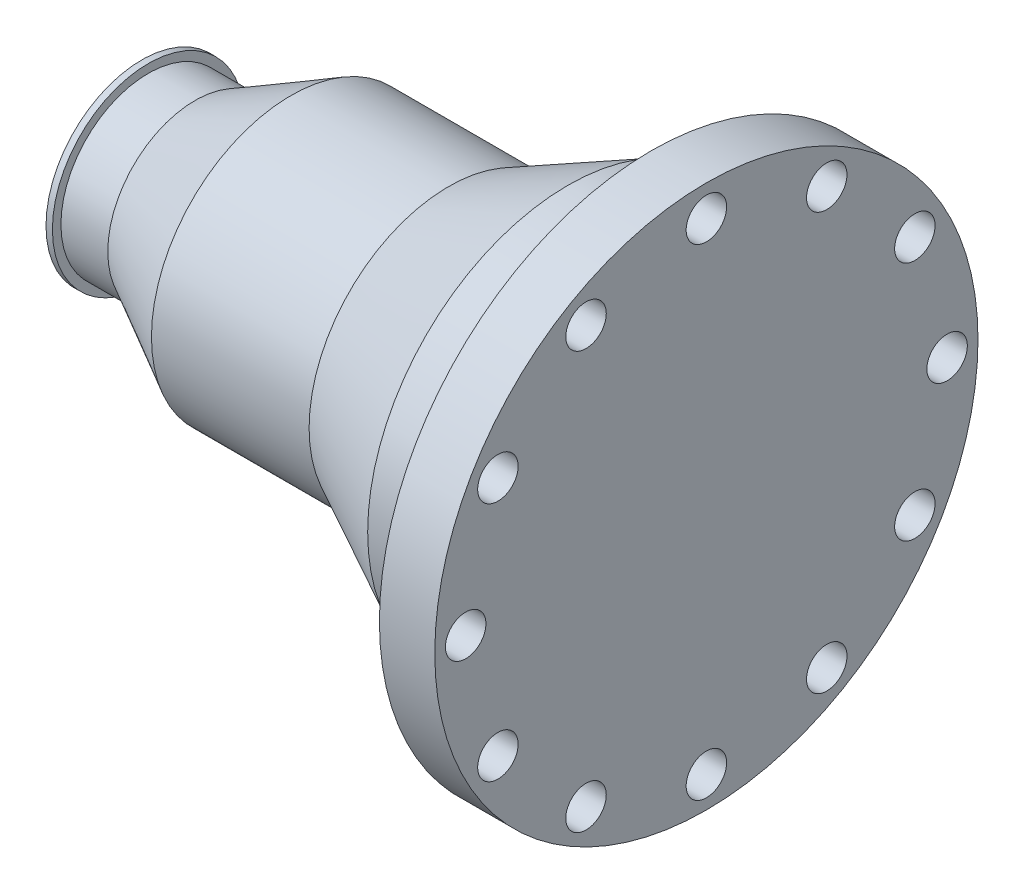
from build123d import *

# Parameters (mm, degrees)
SKETCH_3_R           = 9.5
CUT_EXTRUDE_1_DEPTH  = 321.526909947
SKETCH_4_R           = 9.5
CUT_EXTRUDE_2_DEPTH  = 321.526909947
SKETCH_5_R           = 9.5
CUT_EXTRUDE_3_DEPTH  = 321.526909947
SKETCH_6_R           = 9.5
CUT_EXTRUDE_4_DEPTH  = 321.526909947
SKETCH_7_R           = 9.5
CUT_EXTRUDE_5_DEPTH  = 321.526909947
SKETCH_8_R           = 9.5
CUT_EXTRUDE_6_DEPTH  = 321.526909947
SKETCH_9_R           = 9.5
CUT_EXTRUDE_7_DEPTH  = 321.526909947
SKETCH_10_R          = 9.5
CUT_EXTRUDE_8_DEPTH  = 321.526909947
SKETCH_11_R          = 9.5
CUT_EXTRUDE_9_DEPTH  = 321.526909947
SKETCH_12_R          = 9.5
CUT_EXTRUDE_10_DEPTH = 321.526909947
SKETCH_13_R          = 9.5
CUT_EXTRUDE_11_DEPTH = 321.526909947
SKETCH_14_R          = 9.5
CUT_EXTRUDE_12_DEPTH = 321.526909947


with BuildPart() as part:
    # Эскиз1 → Повернуть1 (revolve)
    with BuildSketch(Plane.XY, mode=Mode.PRIVATE) as revolve_1_sk:
        Polygon((0, 0), (265, 0), (265, 127.5), (239, 127.5), (239, 100), (239, 95), (220, 95), (220, 94), (200, 94), (144, 65.5), (70, 65.5), (25, 41), (3, 41), (3, 45), (0, 45), align=None)
    revolve(revolve_1_sk.sketch.rotate(Axis((0, 0, 0), (1, 0, 0)), 90), axis=Axis((0, 0, 0), (1, 0, 0)))

    # Эскиз2 → Вырез-Повернуть1 (revolve, cut)
    with BuildSketch(Plane.XY, mode=Mode.PRIVATE) as cut_revolve_1_sk:
        with BuildLine():
            Line((0, 0), (152, 0))
            Line((152, 0), (152, 55))
            Line((152, 55), (147.669872, 55))
            ThreePointArc((147.669872, 55), (146.273624348, 54.108499061), (146.669872, 52.5))
            Line((146.669872, 52.5), (143.5, 52.5))
            ThreePointArc((143.5, 52.5), (142.75, 52.602347572), (142, 52.5))
            Line((142, 52.5), (90, 52.5))
            ThreePointArc((90, 52.5), (79.13262933, 46.740617582), (70, 38.502577))
            Line((70, 38.502577), (42, 31))
            Line((42, 31), (0, 31))
            Line((0, 31), (0, 0))
        make_face()
    revolve(cut_revolve_1_sk.sketch.rotate(Axis((0, 0, 0), (1, 0, 0)), 90), axis=Axis((0, 0, 0), (1, 0, 0)), mode=Mode.SUBTRACT)

    # Эскиз3 → Вырез-Вытянуть1 (cut, through all)
    with BuildSketch(Plane(origin=(0, 0, 0), x_dir=(0, 0, -1), z_dir=(1, 0, 0))):
        with Locations((0, 113)):
            Circle(SKETCH_3_R)
    extrude(amount=CUT_EXTRUDE_1_DEPTH, mode=Mode.SUBTRACT)

    # Эскиз4 → Вырез-Вытянуть2 (cut, through all)
    with BuildSketch(Plane(origin=(0, 0, 0), x_dir=(0, 0, -1), z_dir=(1, 0, 0))):
        with Locations((-56.5, 97.860870628)):
            Circle(SKETCH_4_R)
    extrude(amount=CUT_EXTRUDE_2_DEPTH, mode=Mode.SUBTRACT)

    # Эскиз5 → Вырез-Вытянуть3 (cut, through all)
    with BuildSketch(Plane(origin=(0, 0, 0), x_dir=(0, 0, -1), z_dir=(1, 0, 0))):
        with Locations((-97.860870628, 56.5)):
            Circle(SKETCH_5_R)
    extrude(amount=CUT_EXTRUDE_3_DEPTH, mode=Mode.SUBTRACT)

    # Эскиз6 → Вырез-Вытянуть4 (cut, through all)
    with BuildSketch(Plane(origin=(0, 0, 0), x_dir=(0, 0, -1), z_dir=(1, 0, 0))):
        with Locations((-113, 0)):
            Circle(SKETCH_6_R)
    extrude(amount=CUT_EXTRUDE_4_DEPTH, mode=Mode.SUBTRACT)

    # Эскиз7 → Вырез-Вытянуть5 (cut, through all)
    with BuildSketch(Plane(origin=(0, 0, 0), x_dir=(0, 0, -1), z_dir=(1, 0, 0))):
        with Locations((-97.860870628, -56.5)):
            Circle(SKETCH_7_R)
    extrude(amount=CUT_EXTRUDE_5_DEPTH, mode=Mode.SUBTRACT)

    # Эскиз8 → Вырез-Вытянуть6 (cut, through all)
    with BuildSketch(Plane(origin=(0, 0, 0), x_dir=(0, 0, -1), z_dir=(1, 0, 0))):
        with Locations((-56.5, -97.860870628)):
            Circle(SKETCH_8_R)
    extrude(amount=CUT_EXTRUDE_6_DEPTH, mode=Mode.SUBTRACT)

    # Эскиз9 → Вырез-Вытянуть7 (cut, through all)
    with BuildSketch(Plane(origin=(0, 0, 0), x_dir=(0, 0, -1), z_dir=(1, 0, 0))):
        with Locations((0, -113)):
            Circle(SKETCH_9_R)
    extrude(amount=CUT_EXTRUDE_7_DEPTH, mode=Mode.SUBTRACT)

    # Эскиз10 → Вырез-Вытянуть8 (cut, through all)
    with BuildSketch(Plane(origin=(0, 0, 0), x_dir=(0, 0, -1), z_dir=(1, 0, 0))):
        with Locations((56.5, -97.860870628)):
            Circle(SKETCH_10_R)
    extrude(amount=CUT_EXTRUDE_8_DEPTH, mode=Mode.SUBTRACT)

    # Эскиз11 → Вырез-Вытянуть9 (cut, through all)
    with BuildSketch(Plane(origin=(0, 0, 0), x_dir=(0, 0, -1), z_dir=(1, 0, 0))):
        with Locations((97.860870628, -56.5)):
            Circle(SKETCH_11_R)
    extrude(amount=CUT_EXTRUDE_9_DEPTH, mode=Mode.SUBTRACT)

    # Эскиз12 → Вырез-Вытянуть10 (cut, through all)
    with BuildSketch(Plane(origin=(0, 0, 0), x_dir=(0, 0, -1), z_dir=(1, 0, 0))):
        with Locations((113, 0)):
            Circle(SKETCH_12_R)
    extrude(amount=CUT_EXTRUDE_10_DEPTH, mode=Mode.SUBTRACT)

    # Эскиз13 → Вырез-Вытянуть11 (cut, through all)
    with BuildSketch(Plane(origin=(0, 0, 0), x_dir=(0, 0, -1), z_dir=(1, 0, 0))):
        with Locations((97.860870628, 56.5)):
            Circle(SKETCH_13_R)
    extrude(amount=CUT_EXTRUDE_11_DEPTH, mode=Mode.SUBTRACT)

    # Эскиз14 → Вырез-Вытянуть12 (cut, through all)
    with BuildSketch(Plane(origin=(0, 0, 0), x_dir=(0, 0, -1), z_dir=(1, 0, 0))):
        with Locations((56.5, 97.860870628)):
            Circle(SKETCH_14_R)
    extrude(amount=CUT_EXTRUDE_12_DEPTH, mode=Mode.SUBTRACT)


solid = part.part
